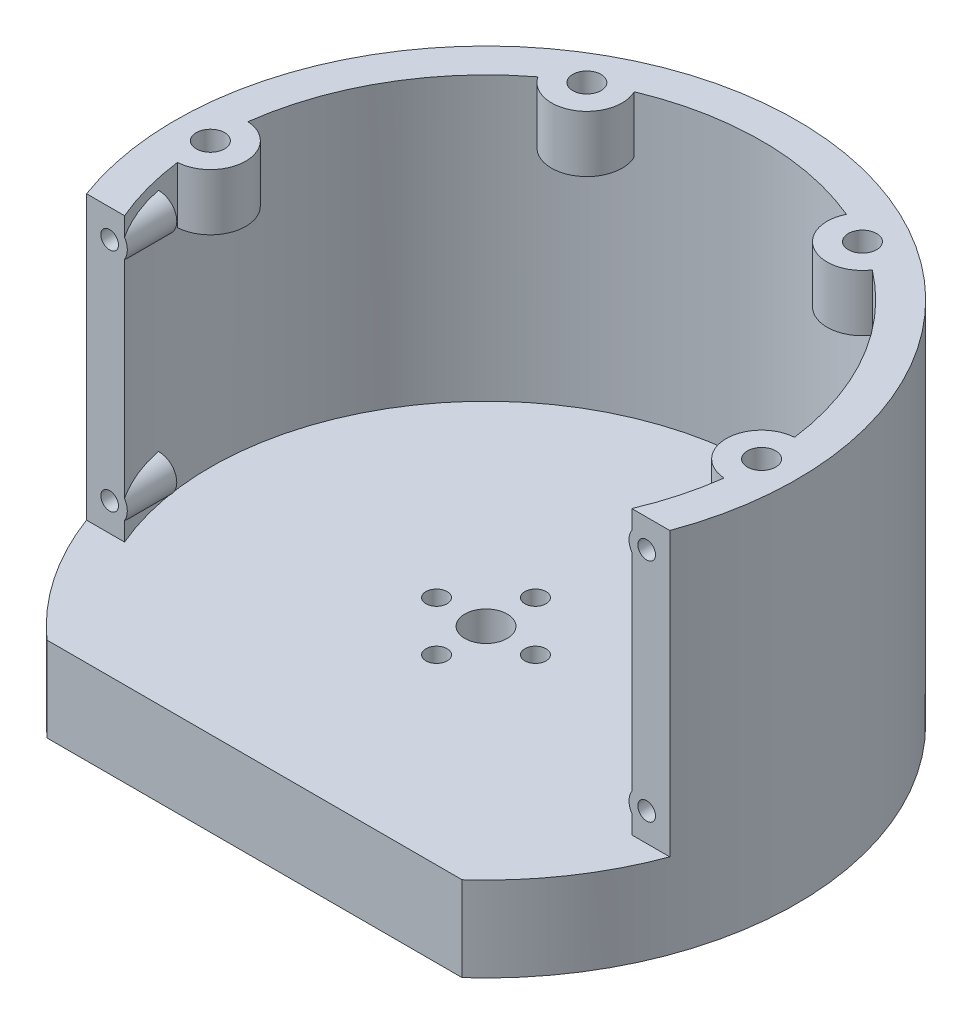
from build123d import *

# Parameters (mm, degrees)
CUT_EXTRUDE_START        = 7
SKETCH_9_R               = 3
SKETCH_9_R_2             = 1.5
CUT_EXTRUDE_1_DEPTH      = 5
CUT_EXTRUDE_START_2      = 55
CUT_EXTRUDE_9_DEPTH      = 43
CUT_EXTRUDE_11_DEPTH     = 74.972968036
EXTRUDE_START            = -8
EXTRUDE_17_DEPTH         = 8
SKETCH_26_R              = 2
CUT_EXTRUDE_12_DEPTH     = 5
PATTERN_CIRCULAR_3_COUNT = 4
PATTERN_CIRCULAR_3_ANGLE = 180
SKETCH_22_R              = 2.5
EXTRUDE_19_DEPTH         = 7
SKETCH_28_R              = 1.25
CUT_EXTRUDE_13_DEPTH     = 5


with BuildPart() as part:
    # Эскиз6 → Повернуть1 (revolve)
    with BuildSketch(Plane(origin=(0, 0, 0), x_dir=(0, 0, -1), z_dir=(1, 0, 0))):
        Polygon((26, 0), (44, 0), (44, 52), (39, 52), (39, 12), (0, 12), (0, 7), (26, 7), align=None)
    revolve(axis=Axis((0, 0, 0), (0, 1, 0)))

    # Эскиз9 → Вырез-Вытянуть1 (cut)
    with BuildSketch(Plane(origin=(0, 0, 0), x_dir=(1, 0, 0), z_dir=(0, 1, 0)).offset(CUT_EXTRUDE_START)):
        with Locations(Location((0, 0, 0), (0, 0, 270))):
            Circle(SKETCH_9_R)
        with Locations(Location((0, 7, 0), (0, 0, 270))):
            Circle(SKETCH_9_R_2)
        with Locations(Location((7, 0, 0), (0, 0, 270))):
            Circle(SKETCH_9_R_2)
        with Locations(Location((0, -7, 0), (0, 0, 270))):
            Circle(SKETCH_9_R_2)
        with Locations(Location((-7, 0, 0), (0, 0, 270))):
            Circle(SKETCH_9_R_2)
    extrude(amount=CUT_EXTRUDE_1_DEPTH, mode=Mode.SUBTRACT)

    # Эскиз21 → Вырез-Вытянуть9 (cut)
    with BuildSketch(Plane(origin=(0, 0, 0), x_dir=(1, 0, 0), z_dir=(0, 1, 0)).offset(CUT_EXTRUDE_START_2)):
        with BuildLine():
            Line((41.269210876, -15.259496508), (-41.269210876, -15.259496508))
            ThreePointArc((-41.269210876, -15.259496508), (0, -44), (41.269210876, -15.259496508))
        make_face()
    extrude(amount=-CUT_EXTRUDE_9_DEPTH, mode=Mode.SUBTRACT)

    # Эскиз23 → Вырез-Вытянуть11 (cut, through all)
    with BuildSketch(Plane(origin=(0, 12, 0), x_dir=(1, 0, 0), z_dir=(0, 1, 0))):
        with BuildLine():
            Line((-29.373719352, -32.759496508), (29.373719352, -32.759496508))
            ThreePointArc((29.373719352, -32.759496508), (0, -44), (-29.373719352, -32.759496508))
        make_face()
    extrude(amount=-CUT_EXTRUDE_11_DEPTH, mode=Mode.SUBTRACT)

    # Эскиз25 → Бобышка-Вытянуть17 (add)
    with BuildSketch(Plane(origin=(0, 52, 0), x_dir=(1, 0, 0), z_dir=(0, 1, 0)).offset(EXTRUDE_START)):
        with BuildLine():
            ThreePointArc((-38.679487179, -4.989716578), (-34, 0), (-38.679487179, 4.989716578))
            ThreePointArc((-38.679487179, 4.989716578), (-39, 0), (-38.679487179, -4.989716578))
        make_face()
    extrude_17 = extrude(amount=EXTRUDE_17_DEPTH)

    # Эскиз26 → Вырез-Вытянуть12 (cut)
    with BuildSketch(Plane(origin=(0, 52, 0), x_dir=(1, 0, 0), z_dir=(0, 1, 0))):
        with Locations(Location((-39, 0, 0), (0, 0, 270))):
            Circle(SKETCH_26_R)
    cut_extrude_12 = extrude(amount=-CUT_EXTRUDE_12_DEPTH, mode=Mode.SUBTRACT)

    # Круговой массив3: Бобышка-Вытянуть17, Вырез-Вытянуть12 ×4 about axis
    pattern_circular_3_axis = Axis((0, 0, 0), (0, -1, 0))
    add([extrude_17.rotate(pattern_circular_3_axis, i * PATTERN_CIRCULAR_3_ANGLE / (PATTERN_CIRCULAR_3_COUNT - 1)) for i in range(1, PATTERN_CIRCULAR_3_COUNT)])
    add([cut_extrude_12.rotate(pattern_circular_3_axis, i * PATTERN_CIRCULAR_3_ANGLE / (PATTERN_CIRCULAR_3_COUNT - 1)) for i in range(1, PATTERN_CIRCULAR_3_COUNT)], mode=Mode.SUBTRACT)

    # Эскиз22 → Бобышка-Вытянуть19 (add)
    with BuildSketch(Plane.XY.offset(15.259496508)):
        with Locations((-38, 16)):
            Circle(SKETCH_22_R)
        with Locations((-38, 48)):
            Circle(SKETCH_22_R)
        with Locations((38, 48)):
            Circle(SKETCH_22_R)
        with Locations((38, 16)):
            Circle(SKETCH_22_R)
    extrude(amount=-EXTRUDE_19_DEPTH)

    # Эскиз28 → Вырез-Вытянуть13 (cut)
    with BuildSketch(Plane.XY.offset(15.259496508)):
        with Locations((-38, 16)):
            Circle(SKETCH_28_R)
        with Locations((-38, 48)):
            Circle(SKETCH_28_R)
        with Locations((38, 48)):
            Circle(SKETCH_28_R)
        with Locations((38, 16)):
            Circle(SKETCH_28_R)
    extrude(amount=-CUT_EXTRUDE_13_DEPTH, mode=Mode.SUBTRACT)


solid = part.part
